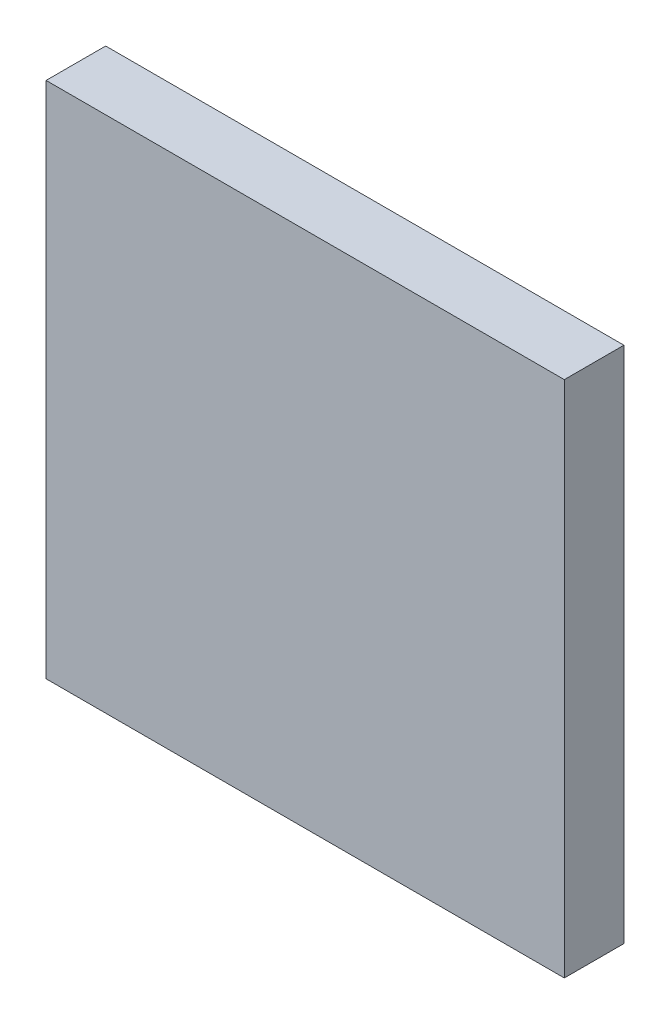
from build123d import *

# Parameters (mm, degrees)
SKETCH1_W           = 25.4
SKETCH1_H           = 25.4
BOSS_EXTRUDE1_DEPTH = 2.921


with BuildPart() as part:
    # Sketch1 → Boss-Extrude1 (new body)
    with BuildSketch(Plane.XY):
        with Locations((12.7, 12.7)):
            Rectangle(SKETCH1_W, SKETCH1_H)
    extrude(amount=-BOSS_EXTRUDE1_DEPTH)


solid = part.part
